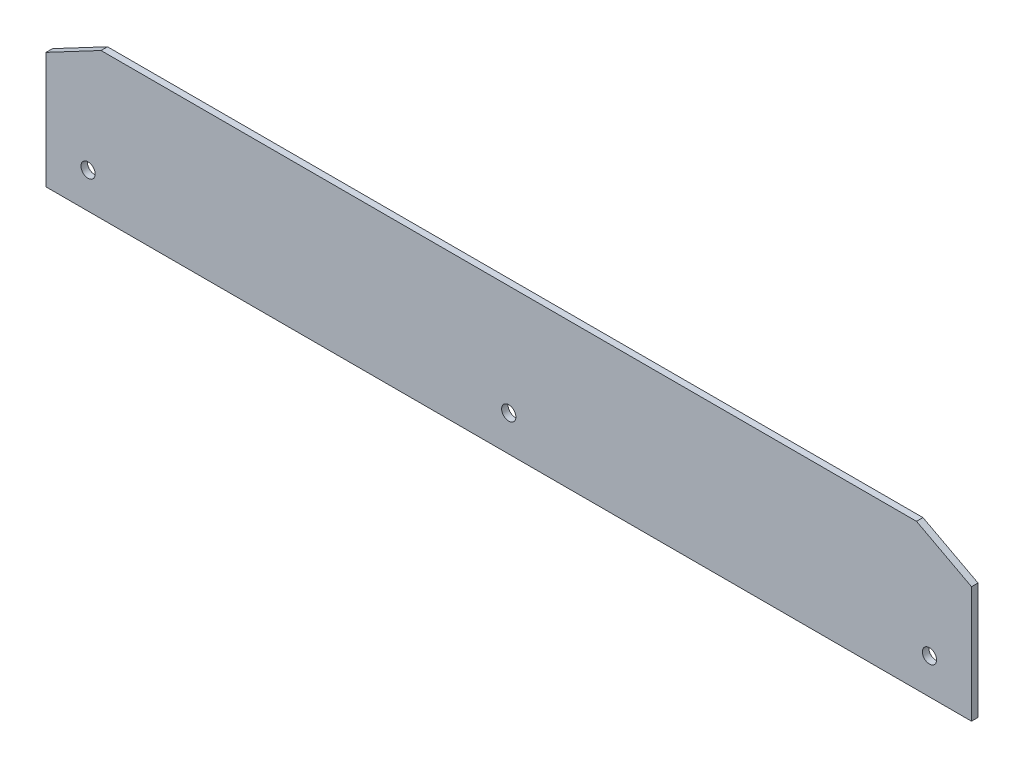
from build123d import *

# Parameters (mm, degrees)
LOW_REAR_PROTECTION_PROFILE_R = 2.2
LOW_REAR_PROTECTION_DEPTH     = 2


with BuildPart() as part:
    # Low rear protection profile → Low rear protection (new body)
    with BuildSketch(Plane.XY):
        Polygon((-143, 7), (143, 7), (143, 43), (126, 52), (-126, 52), (-143, 43), align=None)
        with Locations((-130, 18)):
            Circle(LOW_REAR_PROTECTION_PROFILE_R, mode=Mode.SUBTRACT)
        with Locations((0, 18)):
            Circle(LOW_REAR_PROTECTION_PROFILE_R, mode=Mode.SUBTRACT)
        with Locations((130, 18)):
            Circle(LOW_REAR_PROTECTION_PROFILE_R, mode=Mode.SUBTRACT)
    extrude(amount=LOW_REAR_PROTECTION_DEPTH)


solid = part.part
